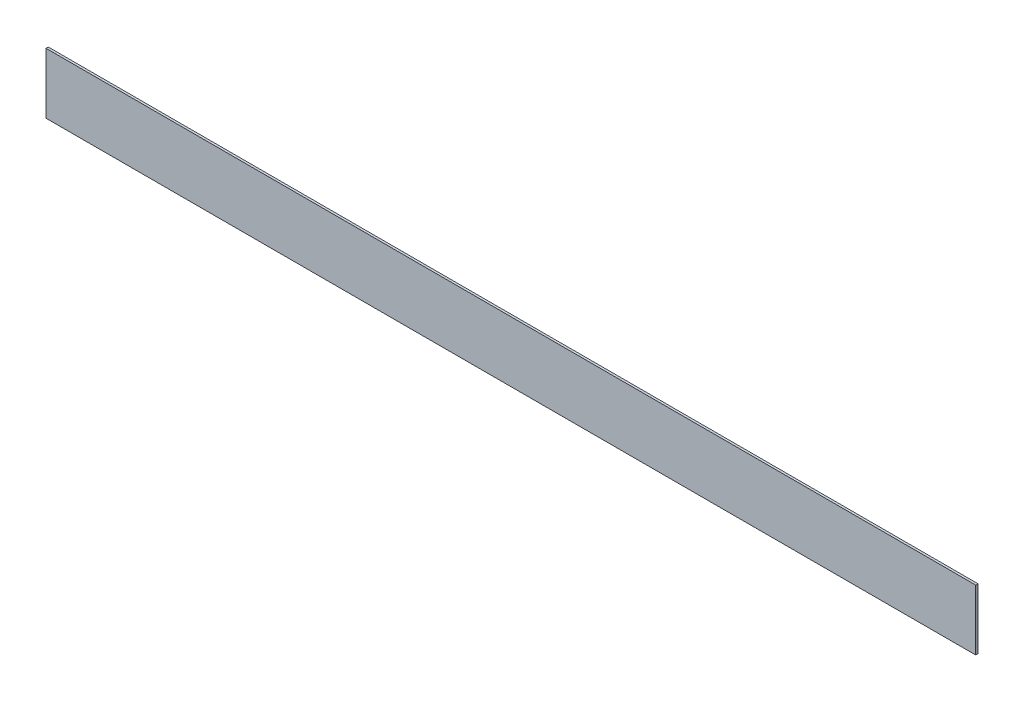
from build123d import *

# Parameters (mm, degrees)
SKETCH_1_W      = 2056
SKETCH_1_H      = 134
EXTRUDE_1_DEPTH = 5


with BuildPart() as part:
    # 草图1 → 凸台-拉伸1 (new body)
    with BuildSketch(Plane.XY):
        with Locations((1028, -67)):
            Rectangle(SKETCH_1_W, SKETCH_1_H)
    extrude(amount=EXTRUDE_1_DEPTH)


solid = part.part
